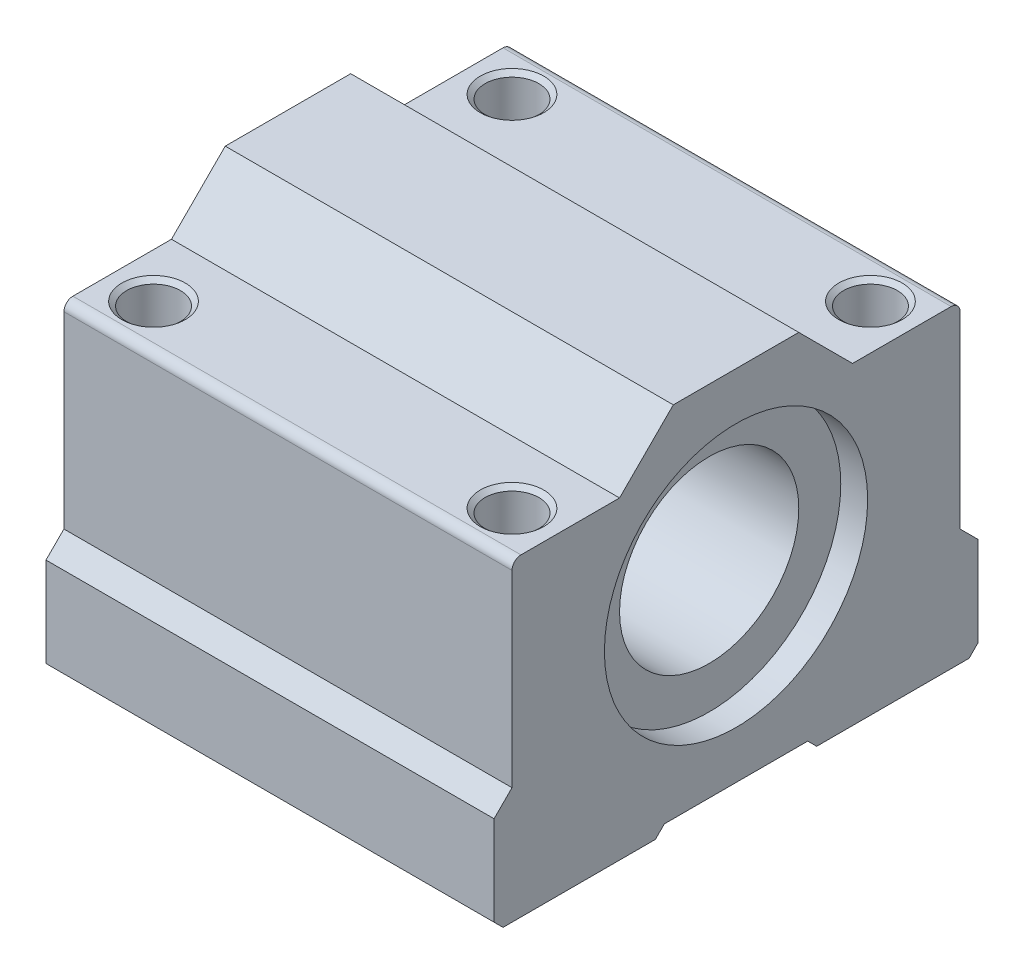
from build123d import *

# Parameters (mm, degrees)
SKETCH1_R                                         = 10
BOSS_EXTRUDE1_DEPTH                               = 50
FILLET1_R                                         = 1
SKETCH2_R                                         = 3
CUT_EXTRUDE1_DEPTH                                = 50
SKETCH3_R                                         = 3
CUT_EXTRUDE2_DEPTH                                = 85.243694126
CSK_FOR_8_FLAT_HEAD_MACHINE_SCREW_100_D           = 4.4958
CSK_FOR_8_FLAT_HEAD_MACHINE_SCREW_100_CSINK_D     = 8.4328
CSK_FOR_8_FLAT_HEAD_MACHINE_SCREW_100_CSINK_ANGLE = 100
CSK_FOR_6_FLAT_HEAD_MACHINE_SCREW_100_D           = 3.7973
CSK_FOR_6_FLAT_HEAD_MACHINE_SCREW_100_CSINK_D     = 7.0866
CSK_FOR_6_FLAT_HEAD_MACHINE_SCREW_100_CSINK_ANGLE = 100
SKETCH14_R                                        = 14.687199229
CUT_EXTRUDE3_DEPTH                                = 3
SKETCH15_R                                        = 14.460805981
CUT_EXTRUDE4_DEPTH                                = 3


with BuildPart() as part:
    # Sketch1 → Boss-Extrude1 (new body)
    with BuildSketch(Plane(origin=(0, 0, 0), x_dir=(0, 0, -1), z_dir=(1, 0, 0))):
        Polygon((53, 0), (54, 1), (54, 11), (52, 13), (52, 35), (40, 35), (34, 41), (20, 41), (14, 35), (2, 35), (2, 13), (0, 11), (0, 1), (1, 0), (18, 0), (19, 1), (35, 1), (36, 0), align=None)
        with Locations((27, 21)):
            Circle(SKETCH1_R, mode=Mode.SUBTRACT)
    extrude(amount=BOSS_EXTRUDE1_DEPTH)

    # Fillet1
    fillet1_edges = [part.edges().sort_by_distance(p)[0] for p in [
        (25, 35, -2),
        (25, 35, -52),
    ]]
    fillet(fillet1_edges, radius=FILLET1_R)

    # Sketch2 → Cut-Extrude1 (cut)
    with BuildSketch(Plane.XZ):
        with Locations(Location((5, -7, 0), (0, 0, 270))):
            Circle(SKETCH2_R)
        with Locations(Location((45, -7, 0), (0, 0, 270))):
            Circle(SKETCH2_R)
    extrude(amount=-CUT_EXTRUDE1_DEPTH, mode=Mode.SUBTRACT)

    # Sketch3 → Cut-Extrude2 (cut, through all)
    with BuildSketch(Plane.XZ):
        with Locations(Location((5, -47, 0), (0, 0, 270))):
            Circle(SKETCH3_R)
        with Locations(Location((45, -47, 0), (0, 0, 270))):
            Circle(SKETCH3_R)
    extrude(amount=-CUT_EXTRUDE2_DEPTH, mode=Mode.SUBTRACT)

    # CSK for #8 Flat Head Machine Screw (100)1 (through all)
    with Locations(Plane(origin=(0, 0, 0), x_dir=(-1, 0, 0), z_dir=(0, -1, 0))):
        with Locations((-45, 7), (-5, 7), (-5, 47), (-45, 47)):
            CounterSinkHole(CSK_FOR_8_FLAT_HEAD_MACHINE_SCREW_100_D / 2, CSK_FOR_8_FLAT_HEAD_MACHINE_SCREW_100_CSINK_D / 2, counter_sink_angle=CSK_FOR_8_FLAT_HEAD_MACHINE_SCREW_100_CSINK_ANGLE)

    # CSK for #6 Flat Head Machine Screw (100)1 (through all)
    with Locations(Plane(origin=(0, 35, 0), x_dir=(1, 0, 0), z_dir=(0, 1, 0))):
        with Locations((5, 47), (45, 47), (45, 7), (5, 7)):
            CounterSinkHole(CSK_FOR_6_FLAT_HEAD_MACHINE_SCREW_100_D / 2, CSK_FOR_6_FLAT_HEAD_MACHINE_SCREW_100_CSINK_D / 2, counter_sink_angle=CSK_FOR_6_FLAT_HEAD_MACHINE_SCREW_100_CSINK_ANGLE)

    # Sketch14 → Cut-Extrude3 (cut)
    with BuildSketch(Plane(origin=(50, 0, 0), x_dir=(0, 0, -1), z_dir=(1, 0, 0))):
        with Locations((27, 21)):
            Circle(SKETCH14_R)
    extrude(amount=-CUT_EXTRUDE3_DEPTH, mode=Mode.SUBTRACT)

    # Sketch15 → Cut-Extrude4 (cut)
    with BuildSketch(Plane.ZY):
        with Locations((-27, 21)):
            Circle(SKETCH15_R)
    extrude(amount=-CUT_EXTRUDE4_DEPTH, mode=Mode.SUBTRACT)


solid = part.part
